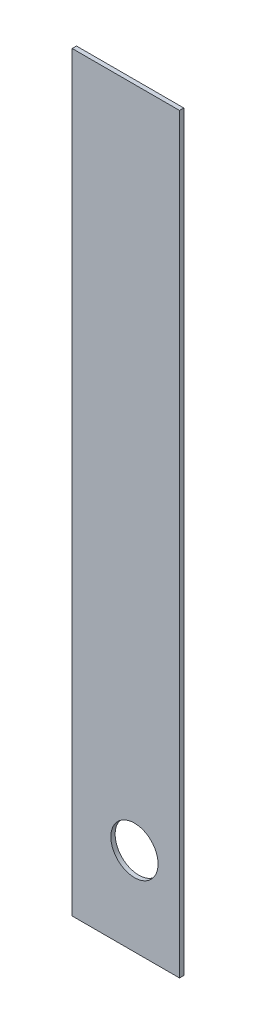
from build123d import *

# Parameters (mm, degrees)
BOSS_EXTRUDE1_DEPTH      = 200
BOSS_EXTRUDE1_DEPTH_BACK = 150
SKETCH1_W                = 50
SKETCH1_H                = 2
SKETCH2_R                = 11
CUT_EXTRUDE1_DEPTH       = 202.566366242


with BuildPart() as part:
    # Sketch1 → Boss-Extrude1 (new, two sides: drawn at the far end of the back side and taken through both)
    with BuildSketch(Plane(origin=(0, 0, 0), x_dir=(1, 0, 0), z_dir=(0, 1, 0)).offset(-BOSS_EXTRUDE1_DEPTH_BACK)):
        Rectangle(SKETCH1_W, SKETCH1_H)
    extrude(amount=BOSS_EXTRUDE1_DEPTH + BOSS_EXTRUDE1_DEPTH_BACK)

    # Sketch2 → Cut-Extrude1 (cut, through all)
    with BuildSketch(Plane(origin=(0, 0, -1), x_dir=(-1, 0, 0), z_dir=(0, 0, -1))):
        with Locations((-4, -109)):
            Circle(SKETCH2_R)
    extrude(amount=-CUT_EXTRUDE1_DEPTH, mode=Mode.SUBTRACT)


solid = part.part
